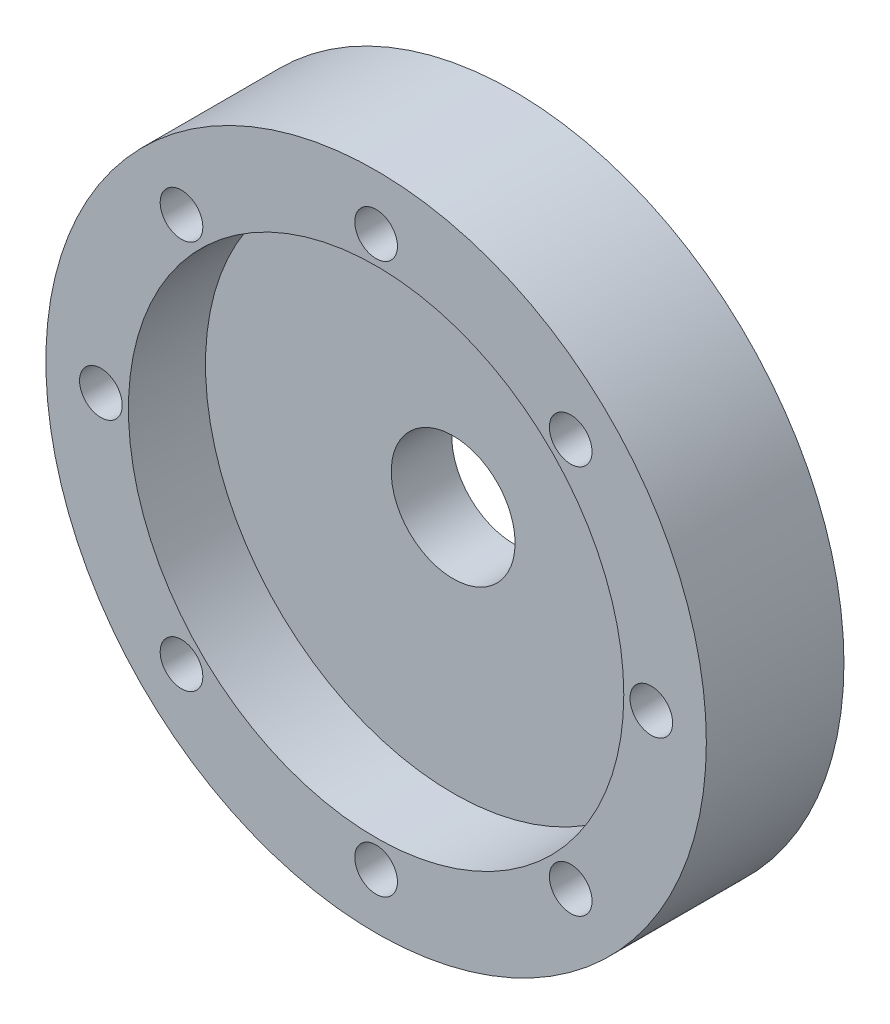
from build123d import *

# Parameters (mm, degrees)
SKETCH6_R           = 24
SKETCH6_R_2         = 1.55
SKETCH6_R_3         = 4.5
BOSS_EXTRUDE1_DEPTH = 10
SKETCH8_R           = 3.5
CUT_EXTRUDE6_DEPTH  = 3
SKETCH9_R           = 18
CUT_EXTRUDE7_DEPTH  = 5.6


with BuildPart() as part:
    # Sketch6 → Boss-Extrude1 (new body)
    with BuildSketch(Plane.XY):
        Circle(SKETCH6_R)
        with Locations((0, 20)):
            Circle(SKETCH6_R_2, mode=Mode.SUBTRACT)
        with Locations((14.142135624, 14.142135624)):
            Circle(SKETCH6_R_2, mode=Mode.SUBTRACT)
        with Locations((20, 0)):
            Circle(SKETCH6_R_2, mode=Mode.SUBTRACT)
        with Locations((14.142135624, -14.142135624)):
            Circle(SKETCH6_R_2, mode=Mode.SUBTRACT)
        with Locations((0, -20)):
            Circle(SKETCH6_R_2, mode=Mode.SUBTRACT)
        with Locations((-14.142135624, -14.142135624)):
            Circle(SKETCH6_R_2, mode=Mode.SUBTRACT)
        with Locations((-20, 0)):
            Circle(SKETCH6_R_2, mode=Mode.SUBTRACT)
        with Locations((-14.142135624, 14.142135624)):
            Circle(SKETCH6_R_2, mode=Mode.SUBTRACT)
        Circle(SKETCH6_R_3, mode=Mode.SUBTRACT)
    extrude(amount=BOSS_EXTRUDE1_DEPTH)

    # Sketch8 → Cut-Extrude6 (cut)
    with BuildSketch(Plane(origin=(0, 0, 0), x_dir=(-1, 0, 0), z_dir=(0, 0, -1))):
        with Locations((0, 20)):
            Circle(SKETCH8_R)
        with Locations((14.142135624, 14.142135624)):
            Circle(SKETCH8_R)
        with Locations((20, 0)):
            Circle(SKETCH8_R)
        with Locations((14.142135624, -14.142135624)):
            Circle(SKETCH8_R)
        with Locations((0, -20)):
            Circle(SKETCH8_R)
        with Locations((-14.142135624, -14.142135624)):
            Circle(SKETCH8_R)
        with Locations((-20, 0)):
            Circle(SKETCH8_R)
        with Locations((-14.142135624, 14.142135624)):
            Circle(SKETCH8_R)
    extrude(amount=-CUT_EXTRUDE6_DEPTH, mode=Mode.SUBTRACT)

    # Sketch9 → Cut-Extrude7 (cut)
    with BuildSketch(Plane.XY.offset(10)):
        Circle(SKETCH9_R)
    extrude(amount=-CUT_EXTRUDE7_DEPTH, mode=Mode.SUBTRACT)


solid = part.part
